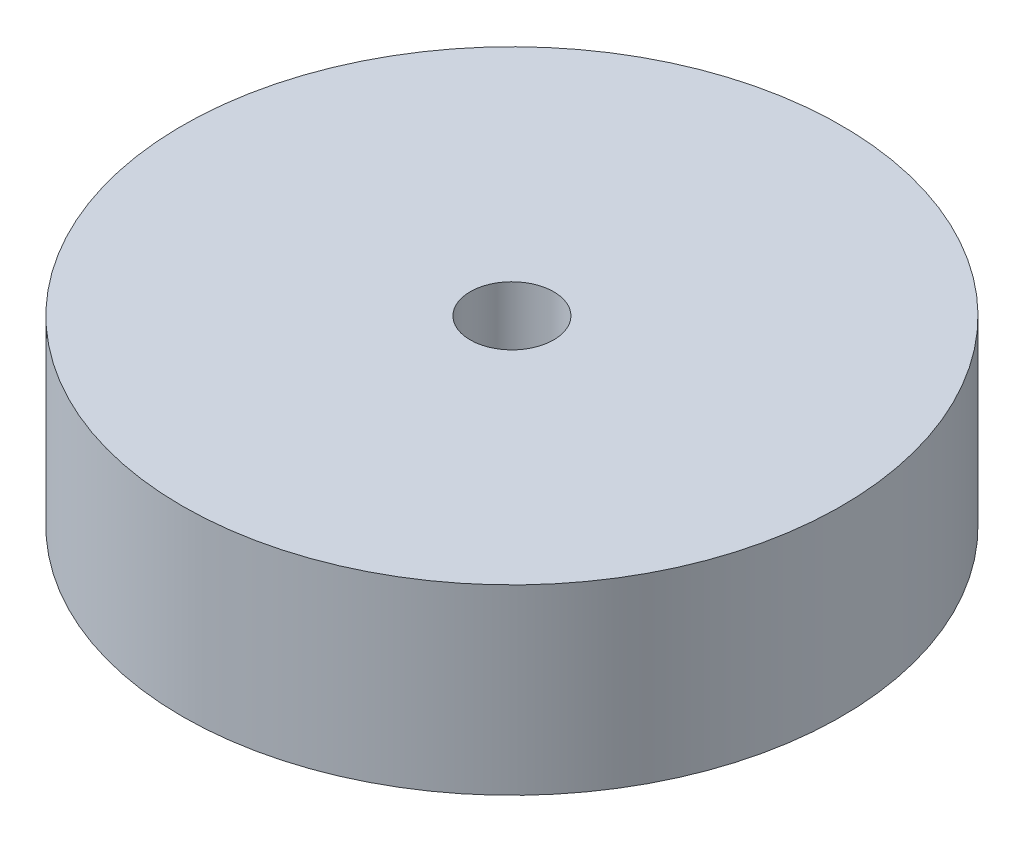
from build123d import *

# Parameters (mm, degrees)
SKETCH1_R           = 10.85
SKETCH1_R_2         = 1.375
BOSS_EXTRUDE1_DEPTH = 6


with BuildPart() as part:
    # Sketch1 → Boss-Extrude1 (new body)
    with BuildSketch(Plane(origin=(0, 0, 0), x_dir=(1, 0, 0), z_dir=(0, 1, 0))):
        with Locations(Location((0, 0, 0), (0, 0, 270))):
            Circle(SKETCH1_R)
        with Locations(Location((0, 0, 0), (0, 0, 270))):
            Circle(SKETCH1_R_2, mode=Mode.SUBTRACT)
    extrude(amount=BOSS_EXTRUDE1_DEPTH)


solid = part.part
